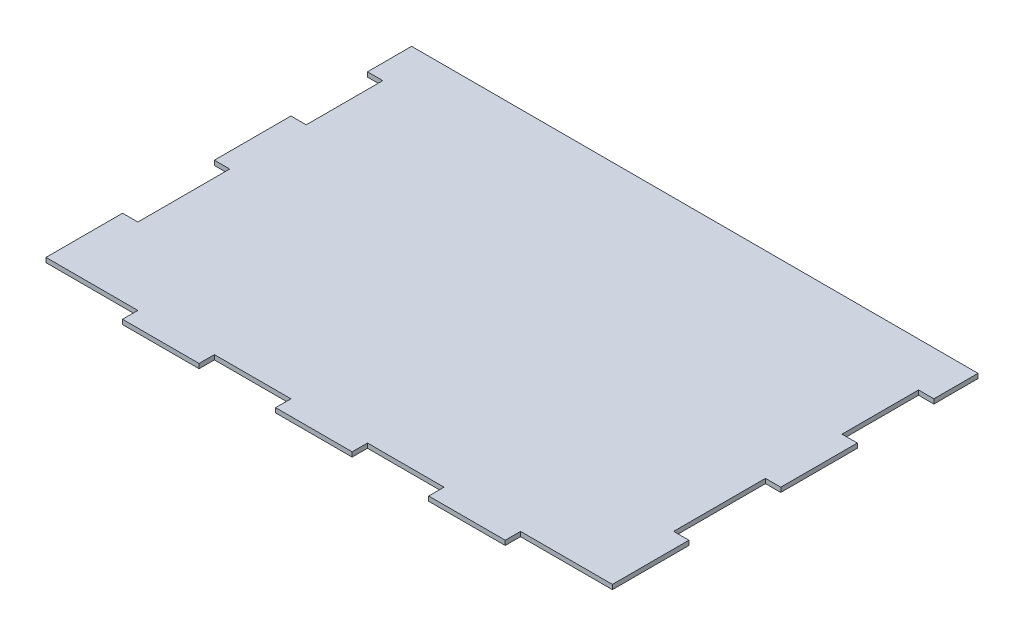
from build123d import *

# Parameters (mm, degrees)
EXTRUDE_1_DEPTH = 3


with BuildPart() as part:
    # 스케치1 → 보스-돌출1 (new body)
    with BuildSketch(Plane(origin=(0, 0, 0), x_dir=(1, 0, 0), z_dir=(0, 1, 0))):
        Polygon((185, 60.565940594), (185, 89.405940594), (-185, 89.405940594), (-185, 60.565940594), (-175, 60.565940594), (-175, 10.565940594), (-185, 10.565940594), (-185, -39.434059406), (-175, -39.434059406), (-175, -99.434059406), (-185, -99.434059406), (-185, -149.434059406), (-175, -149.434059406), (-125, -149.434059406), (-125, -159.434059406), (-75, -159.434059406), (-75, -149.434059406), (-25, -149.434059406), (-25, -159.434059406), (25, -159.434059406), (25, -149.434059406), (75, -149.434059406), (75, -159.434059406), (125, -159.434059406), (125, -149.434059406), (175, -149.434059406), (185, -149.434059406), (185, -99.434059406), (175, -99.434059406), (175, -39.434059406), (185, -39.434059406), (185, 10.565940594), (175, 10.565940594), (175, 60.565940594), align=None)
    extrude(amount=EXTRUDE_1_DEPTH)


solid = part.part
